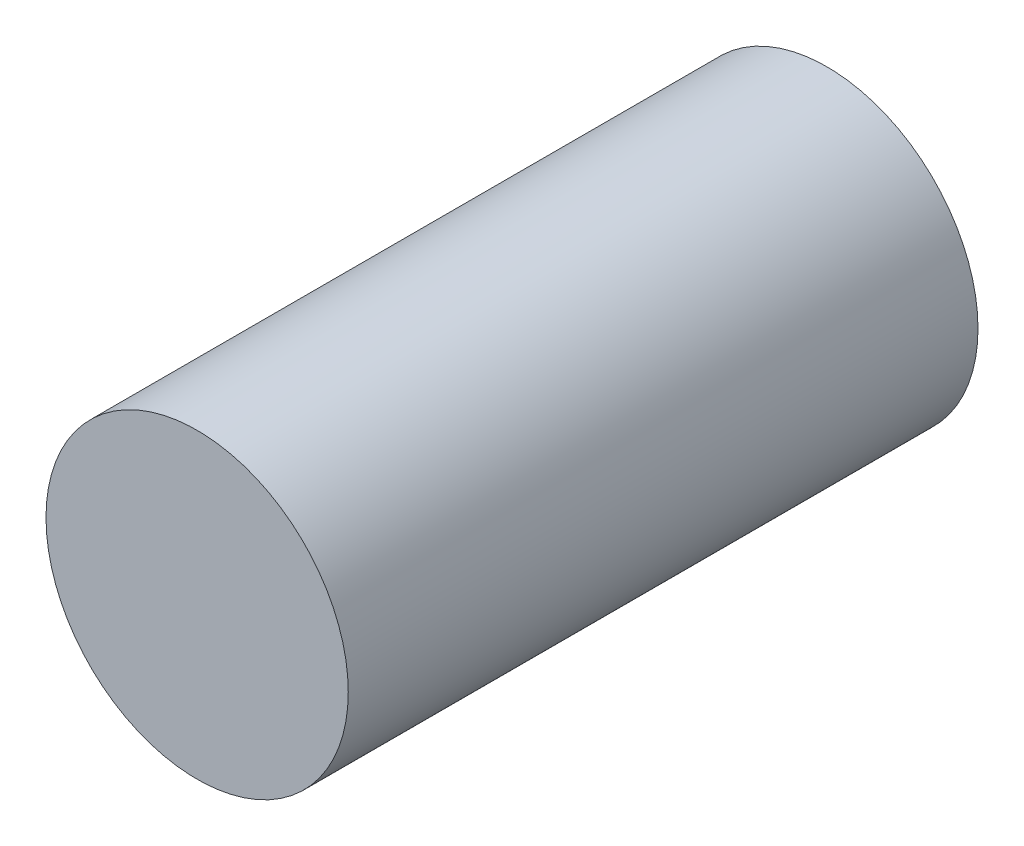
from build123d import *

# Parameters (mm, degrees)
SKETCH1_R           = 6
BOSS_EXTRUDE1_DEPTH = 25


with BuildPart() as part:
    # Sketch1 → Boss-Extrude1 (new body)
    with BuildSketch(Plane.XY):
        Circle(SKETCH1_R)
    extrude(amount=BOSS_EXTRUDE1_DEPTH)


solid = part.part
